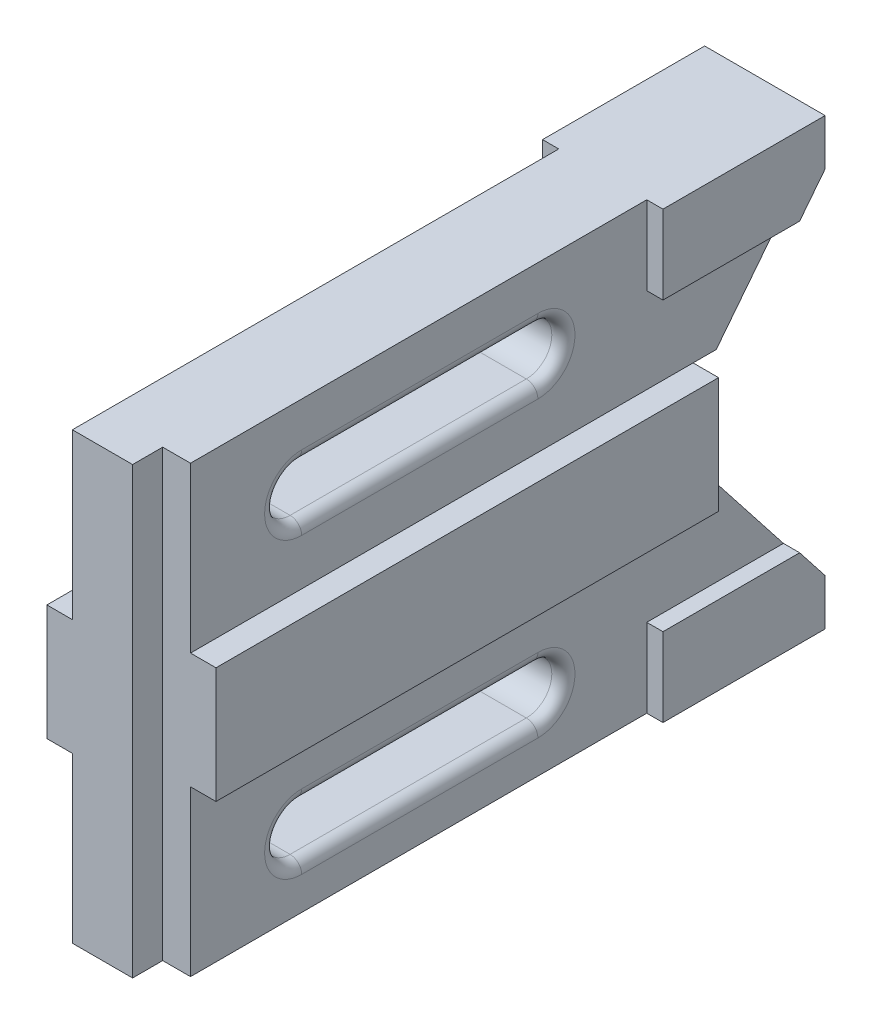
from build123d import *

# Parameters (mm, degrees)
SKETCH1_W           = 30
SKETCH1_H           = 25
BOSS_EXTRUDE1_DEPTH = 115
BOSS_EXTRUDE2_DEPTH = 9.5
SKETCH4_W           = 11.5
SKETCH4_H           = 6.5
CUT_EXTRUDE1_DEPTH  = 151.552316488
BOSS_EXTRUDE3_DEPTH = 13
CUT_EXTRUDE2_DEPTH  = 128.000984248
FILLET1_R           = 2.5
FILLET2_R           = 2.5


with BuildPart() as part:
    # Sketch1 → Boss-Extrude1 (new body)
    with BuildSketch(Plane.XY):
        Rectangle(SKETCH1_W, SKETCH1_H)
    extrude(amount=BOSS_EXTRUDE1_DEPTH)

    # Sketch3 → Boss-Extrude2 (add, symmetric)
    with BuildSketch(Plane(origin=(0, 0, 0), x_dir=(0, 0, -1), z_dir=(1, 0, 0))):
        Polygon((5, -12.5), (0, -12.5), (-115, -12.5), (-115, -48), (25, -48), (25, -38), align=None)
        Polygon((-115, 48), (25, 48), (25, 38), (5, 12.5), (0, 12.5), (-115, 12.5), align=None)
    extrude(amount=BOSS_EXTRUDE2_DEPTH, both=True)

    # Sketch4 → Cut-Extrude1 (cut, through all)
    with BuildSketch(Plane(origin=(0, 48, 0), x_dir=(1, 0, 0), z_dir=(0, 1, 0))):
        with Locations((9.25, -111.75)):
            Rectangle(SKETCH4_W, SKETCH4_H)
    extrude(amount=-CUT_EXTRUDE1_DEPTH, mode=Mode.SUBTRACT)

    # Sketch6 → Boss-Extrude3 (add, symmetric)
    with BuildSketch(Plane(origin=(0, 0, 0), x_dir=(0, 0, -1), z_dir=(1, 0, 0))):
        Polygon((-10, 48), (25, 48), (25, 38), (19.509803922, 31), (-10, 31), align=None)
        Polygon((25, -48), (-10, -48), (-10, -31), (19.509803922, -31), (25, -38), align=None)
    extrude(amount=BOSS_EXTRUDE3_DEPTH, both=True)

    # Sketch7 → Cut-Extrude2 (cut, through all)
    with BuildSketch(Plane(origin=(9.5, 0, 0), x_dir=(0, 0, -1), z_dir=(1, 0, 0))):
        with BuildLine():
            Line((-84.5, 36), (-33.5, 36))
            ThreePointArc((-33.5, 36), (-28, 30.5), (-33.5, 25))
            Line((-33.5, 25), (-84.5, 25))
            ThreePointArc((-84.5, 25), (-90, 30.5), (-84.5, 36))
        make_face()
        with BuildLine():
            Line((-84.5, -27.384190741), (-33.5, -27.384190741))
            ThreePointArc((-33.5, -27.384190741), (-28, -32.884190741), (-33.5, -38.384190741))
            Line((-33.5, -38.384190741), (-84.5, -38.384190741))
            ThreePointArc((-84.5, -38.384190741), (-90, -32.884190741), (-84.5, -27.384190741))
        make_face()
    extrude(amount=-CUT_EXTRUDE2_DEPTH, mode=Mode.SUBTRACT)

    # Fillet1
    fillet1_edges = [part.edges().sort_by_distance(p)[0] for p in [
        (9.5, 30.5, 90),
        (9.5, 25, 59),
        (9.5, 30.5, 28),
        (9.5, 36, 59),
    ]]
    fillet(fillet1_edges, radius=FILLET1_R)

    # Fillet2
    fillet2_edges = [part.edges().sort_by_distance(p)[0] for p in [
        (-9.5, 25, 59),
        (-9.5, 30.5, 28),
        (-9.5, 36, 59),
        (-9.5, 30.5, 90),
        (-9.5, -38.384190741, 59),
        (-9.5, -32.884190741, 28),
        (-9.5, -27.384190741, 59),
        (-9.5, -32.884190741, 90),
        (9.5, -32.884190741, 90),
        (9.5, -38.384190741, 59),
        (9.5, -32.884190741, 28),
        (9.5, -27.384190741, 59),
    ]]
    fillet(fillet2_edges, radius=FILLET2_R)


solid = part.part
